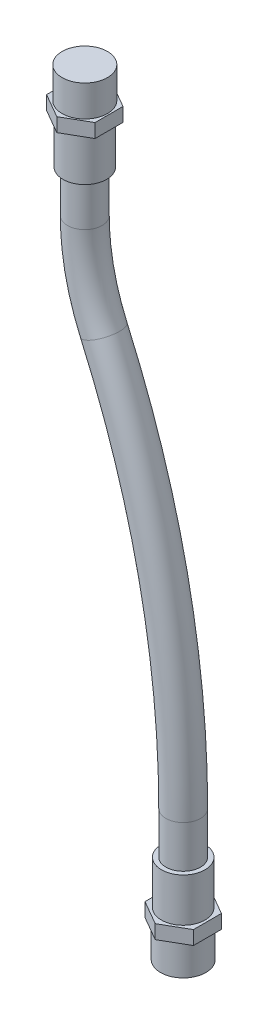
from build123d import *

# Parameters (mm, degrees)
SKETCH2_R           = 3.96875
BOSS_EXTRUDE1_DEPTH = 3.175
SKETCH4_R           = 5.202174
BOSS_EXTRUDE2_DEPTH = 7.15
BOSS_EXTRUDE3_DEPTH = 3.175
SKETCH6_R           = 5.202174
BOSS_EXTRUDE4_DEPTH = 7.15
SKETCH7_R           = 5
BOSS_EXTRUDE5_DEPTH = 10
SKETCH8_R           = 5
BOSS_EXTRUDE6_DEPTH = 10


with BuildPart() as part:
    # Sweep1: sweep along a path in Sketch1
    with BuildLine(Plane.XY) as sweep1_path:
        Line((0, -7.15), (0, -30))
        ThreePointArc((0, -30), (1.104131212, -40.53378495), (4.368528558, -50.609669084))
        ThreePointArc((4.368528558, -50.609669084), (17.974218676, -92.604972545), (22.57613, -136.508762))
        Line((22.57613, -136.508762), (22.57613, -159.358762))
    # Sketch2 → Sweep1 (sweep)
    with BuildSketch(Plane(origin=(0, -7.15, 0), x_dir=(1, 0, 0), z_dir=(0, 1, 0))):
        Circle(SKETCH2_R)
    sweep(path=sweep1_path.line)

    # Sketch3 → Boss-Extrude1 (add)
    with BuildSketch(Plane(origin=(0, -7.15, 0), x_dir=(1, 0, 0), z_dir=(0, 1, 0))):
        Polygon((0, 6.415804866), (-5.55625, 3.207902433), (-5.55625, -3.207902433), (0, -6.415804866), (5.55625, -3.207902433), (5.55625, 3.207902433), align=None)
    extrude(amount=-BOSS_EXTRUDE1_DEPTH)

    # Sketch4 → Boss-Extrude2 (add)
    with BuildSketch(Plane(origin=(0, -7.15, 0), x_dir=(1, 0, 0), z_dir=(0, 1, 0))):
        with Locations(Location((0, 0, 0), (0, 0, 270))):
            Circle(SKETCH4_R)
    extrude(amount=BOSS_EXTRUDE2_DEPTH)

    # Sketch5 → Boss-Extrude3 (add)
    with BuildSketch(Plane.XZ.offset(159.358762)):
        Polygon((22.57613, 6.415804866), (17.01988, 3.207902433), (17.01988, -3.207902433), (22.57613, -6.415804866), (28.13238, -3.207902433), (28.13238, 3.207902433), align=None)
    extrude(amount=-BOSS_EXTRUDE3_DEPTH)

    # Sketch6 → Boss-Extrude4 (add)
    with BuildSketch(Plane.XZ.offset(159.358762)):
        with Locations(Location((22.57613, 0, 0), (0, 0, 270))):
            Circle(SKETCH6_R)
    extrude(amount=BOSS_EXTRUDE4_DEPTH)

    # Sketch7 → Boss-Extrude5 (add)
    with BuildSketch(Plane.XZ.offset(10.325)):
        with Locations(Location((0, 0, 0), (0, 0, 90))):
            Circle(SKETCH7_R)
    extrude(amount=BOSS_EXTRUDE5_DEPTH)

    # Sketch8 → Boss-Extrude6 (add)
    with BuildSketch(Plane(origin=(0, -156.183762, 0), x_dir=(1, 0, 0), z_dir=(0, 1, 0))):
        with Locations(Location((22.57613, 0, 0), (0, 0, 90))):
            Circle(SKETCH8_R)
    extrude(amount=BOSS_EXTRUDE6_DEPTH)


solid = part.part
